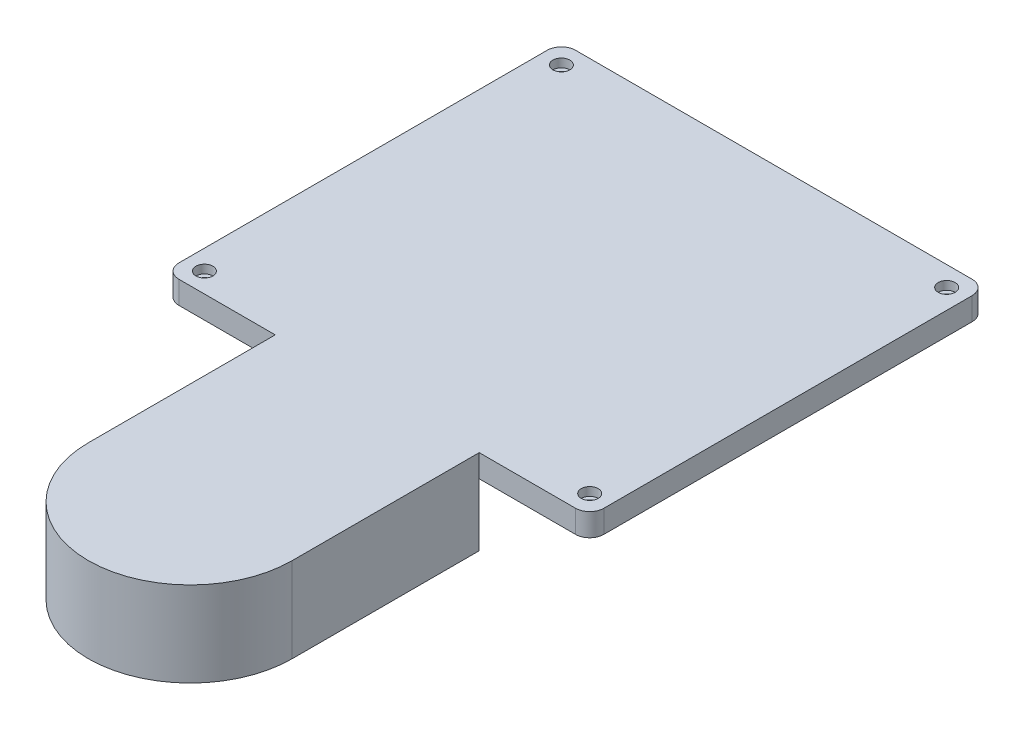
from build123d import *

# Parameters (mm, degrees)
BOSS_EXTRUDE1_DEPTH = 30
SHELL1_T            = -3
BOSS_EXTRUDE2_DEPTH = 8
SKETCH2_R           = 8.5
CUT_EXTRUDE1_DEPTH  = 6.5
SKETCH5_R           = 6
CUT_EXTRUDE4_DEPTH  = 13
BOSS_EXTRUDE3_START = 5
SKETCH6_R           = 9
SKETCH6_R_2         = 6
BOSS_EXTRUDE3_DEPTH = 5
SKETCH7_R           = 4
CUT_EXTRUDE5_DEPTH  = 7
BOSS_EXTRUDE4_START = 5
SKETCH7_3_R         = 6
SKETCH7_3_R_2       = 4
BOSS_EXTRUDE4_DEPTH = 5
SKETCH8_R           = 1.5
CUT_EXTRUDE6_DEPTH  = 221.884585248
SKETCH9_R           = 3
CUT_EXTRUDE7_DEPTH  = 3


with BuildPart() as part:
    # Sketch1 → Boss-Extrude1 (new body)
    with BuildSketch(Plane(origin=(0, 0, 0), x_dir=(1, 0, 0), z_dir=(0, 1, 0))):
        with BuildLine():
            ThreePointArc((-36, 0), (0, -36), (36, 0))
            Line((36, 0), (36, 66))
            Line((36, 66), (-36, 66))
            Line((-36, 66), (-36, 0))
        make_face()
    extrude(amount=-BOSS_EXTRUDE1_DEPTH)

    # Shell1
    shell1_openings = [part.faces().sort_by_distance(p)[0] for p in [
        (0, -15, -66),
    ]]
    offset(amount=SHELL1_T, openings=shell1_openings, kind=Kind.INTERSECTION)

    # Sketch1<3> → Boss-Extrude2 (add)
    with BuildSketch(Plane(origin=(0, 0, 0), x_dir=(1, 0, 0), z_dir=(0, 1, 0))):
        with BuildLine():
            Line((-36, 66), (36, 66))
            Line((36, 66), (70, 66))
            ThreePointArc((70, 66), (73.535533906, 67.464466094), (75, 71))
            Line((75, 71), (75, 201))
            ThreePointArc((75, 201), (73.535533906, 204.535533906), (70, 206))
            Line((70, 206), (-70, 206))
            ThreePointArc((-70, 206), (-73.535533906, 204.535533906), (-75, 201))
            Line((-75, 201), (-75, 71))
            ThreePointArc((-75, 71), (-73.535533906, 67.464466094), (-70, 66))
            Line((-70, 66), (-36, 66))
        make_face()
    extrude(amount=-BOSS_EXTRUDE2_DEPTH)

    # Sketch2 → Cut-Extrude1 (cut)
    with BuildSketch(Plane.XZ.offset(30)):
        with Locations((13, -10.3)):
            Circle(SKETCH2_R)
        with Locations((-13, -10.3)):
            Circle(SKETCH2_R)
    extrude(amount=-CUT_EXTRUDE1_DEPTH, mode=Mode.SUBTRACT)

    # Sketch5 → Cut-Extrude4 (cut)
    with BuildSketch(Plane.XZ.offset(30)):
        with Locations((0, 8)):
            Circle(SKETCH5_R)
    extrude(amount=-CUT_EXTRUDE4_DEPTH, mode=Mode.SUBTRACT)

    # Sketch6 → Boss-Extrude3 (add)
    with BuildSketch(Plane.XZ.offset(30).offset(BOSS_EXTRUDE3_START)):
        with Locations((0, 8)):
            Circle(SKETCH6_R)
        with Locations((0, 8)):
            Circle(SKETCH6_R_2, mode=Mode.SUBTRACT)
    extrude(amount=-BOSS_EXTRUDE3_DEPTH)

    # Sketch7 → Cut-Extrude5 (cut)
    with BuildSketch(Plane.XZ.offset(30)):
        with Locations((0, 24)):
            Circle(SKETCH7_R)
    extrude(amount=-CUT_EXTRUDE5_DEPTH, mode=Mode.SUBTRACT)

    # Sketch7<3> → Boss-Extrude4 (add)
    with BuildSketch(Plane.XZ.offset(30).offset(BOSS_EXTRUDE4_START)):
        with Locations((0, 24)):
            Circle(SKETCH7_3_R)
        with Locations((0, 24)):
            Circle(SKETCH7_3_R_2, mode=Mode.SUBTRACT)
    extrude(amount=-BOSS_EXTRUDE4_DEPTH)

    # Sketch8 → Cut-Extrude6 (cut, through all)
    with BuildSketch(Plane.XZ.offset(8)):
        with Locations((68, -73)):
            Circle(SKETCH8_R)
        with Locations((68, -199)):
            Circle(SKETCH8_R)
        with Locations((-68, -199)):
            Circle(SKETCH8_R)
        with Locations((-68, -73)):
            Circle(SKETCH8_R)
    extrude(amount=-CUT_EXTRUDE6_DEPTH, mode=Mode.SUBTRACT)

    # Sketch9 → Cut-Extrude7 (cut)
    with BuildSketch(Plane(origin=(0, 0, 0), x_dir=(1, 0, 0), z_dir=(0, 1, 0))):
        with Locations((-68, 73)):
            Circle(SKETCH9_R)
        with Locations((-68, 199)):
            Circle(SKETCH9_R)
        with Locations((68, 199)):
            Circle(SKETCH9_R)
        with Locations((68, 73)):
            Circle(SKETCH9_R)
    extrude(amount=-CUT_EXTRUDE7_DEPTH, mode=Mode.SUBTRACT)


solid = part.part
